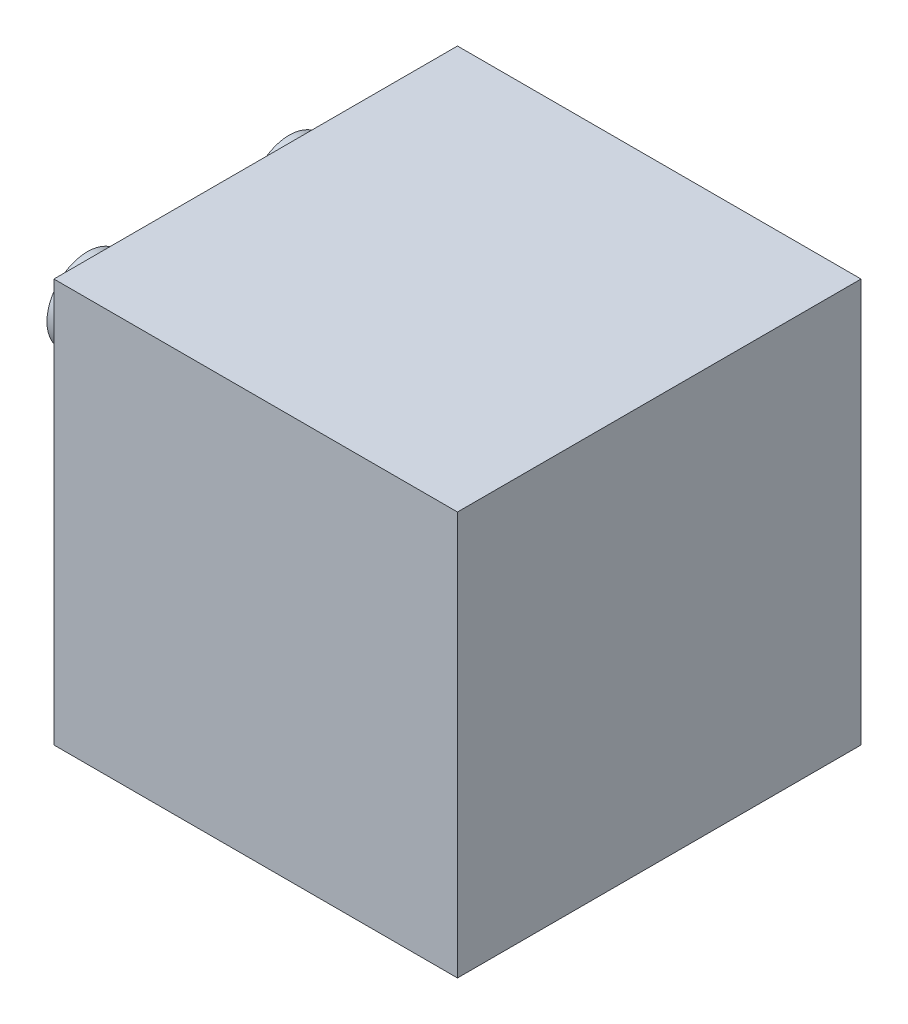
from build123d import *

# Parameters (mm, degrees)
SKETCH1_W           = 59.88
SKETCH1_H           = 59.88
BOSS_EXTRUDE1_DEPTH = 59.88
CUT_EXTRUDE1_DEPTH  = 30
SKETCH4_R           = 6
BOSS_EXTRUDE3_DEPTH = 10
BOSS_EXTRUDE4_DEPTH = 10


with BuildPart() as part:
    # Sketch1 → Boss-Extrude1 (new body)
    with BuildSketch(Plane(origin=(0, 0, 0), x_dir=(1, 0, 0), z_dir=(0, 1, 0))):
        with Locations((-10.472375433, -22.138876894)):
            Rectangle(SKETCH1_W, SKETCH1_H)
    extrude(amount=BOSS_EXTRUDE1_DEPTH)

    # Sketch2 → Cut-Extrude1 (cut)
    with BuildSketch(Plane.XZ):
        Polygon((-10.472375433, 2.168876894), (-10.472375433, 7.168876894), (-10.472375433, 12.168876894), (-11.972375433, 12.168876894), (-11.972375433, 2.168876894), align=None)
        Polygon((-10.472375433, 12.168876894), (-10.472375433, 7.168876894), (-10.472375433, 2.168876894), (-8.972375433, 2.168876894), (-8.972375433, 12.168876894), align=None)
        Polygon((-8.972375433, 32.108876894), (-10.472375433, 32.108876894), (-11.972375433, 32.108876894), (-11.972375433, 42.108876894), (-8.972375433, 42.108876894), align=None)
    extrude(amount=-CUT_EXTRUDE1_DEPTH, mode=Mode.SUBTRACT)

    # Sketch4 → Boss-Extrude3 (add)
    with BuildSketch(Plane.ZY.offset(40.412375433)):
        with Locations(Location((7.168876894, 44.91, 0), (0, 0, 180))):
            Circle(SKETCH4_R)
        with Locations(Location((37.108876894, 44.91, 0), (0, 0, 180))):
            Circle(SKETCH4_R)
    extrude(amount=BOSS_EXTRUDE3_DEPTH)

    # Sketch5 → Boss-Extrude4 (add)
    with BuildSketch(Plane.ZY.offset(40.412375433)):
        Polygon((20.138876894, 21.94), (20.138876894, 35.94), (24.138876894, 35.94), (24.138876894, 29.94), (24.138876894, 21.94), align=None)
        with BuildLine():
            Line((11.199558119, 15.032847323), (32.61038324, 15.032847323))
            add(Edge.make_bspline(
                [(11.199558119, 15.032847323), (22.018966273, 2.880785428), (32.61038324, 15.032847323)],
                knots=[0, 0, 0, 1, 1, 1], degree=2))
        make_face()
    extrude(amount=BOSS_EXTRUDE4_DEPTH)


solid = part.part
